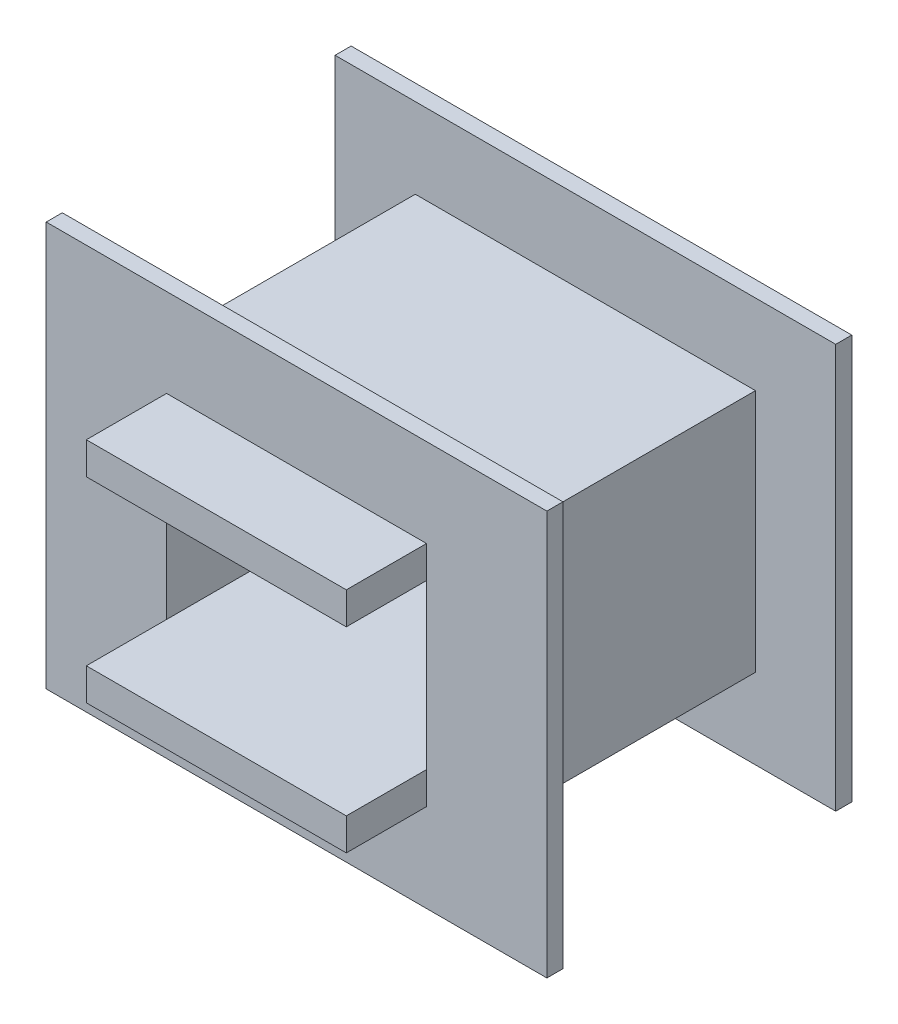
from build123d import *

# Parameters (mm, degrees)
BOSS_EXTRUDE1_DEPTH      = 9.5
BOSS_EXTRUDE1_DEPTH_BACK = 9.5
SKETCH1_W                = 31.2
SKETCH1_H                = 25.2
SKETCH1_W_2              = 16.2
SKETCH1_H_2              = 10.2
SKETCH2_W                = 31.2
SKETCH2_H                = 17
CUT_EXTRUDE1_DEPTH       = 5
SKETCH3_W                = 17
SKETCH3_H                = 15.2
CUT_EXTRUDE2_DEPTH       = 5
SKETCH4_W                = 16.2
SKETCH4_H                = 2
BOSS_EXTRUDE2_DEPTH      = 5
SKETCH6_W                = 16.2
SKETCH6_H                = 5
CUT_EXTRUDE3_DEPTH       = 2


with BuildPart() as part:
    # Sketch1 → Boss-Extrude1 (new, two sides: drawn at the far end of the back side and taken through both)
    with BuildSketch(Plane.XY.offset(-BOSS_EXTRUDE1_DEPTH_BACK)):
        Rectangle(SKETCH1_W, SKETCH1_H)
        Rectangle(SKETCH1_W_2, SKETCH1_H_2, mode=Mode.SUBTRACT)
    extrude(amount=BOSS_EXTRUDE1_DEPTH + BOSS_EXTRUDE1_DEPTH_BACK)

    # Sketch2 → Cut-Extrude1 (cut)
    with BuildSketch(Plane(origin=(0, 12.6, 0), x_dir=(1, 0, 0), z_dir=(0, 1, 0))):
        Rectangle(SKETCH2_W, SKETCH2_H)
    cut_extrude1 = extrude(amount=-CUT_EXTRUDE1_DEPTH, mode=Mode.SUBTRACT)

    # Mirror1: Cut-Extrude1 across plane
    add(cut_extrude1.mirror(Plane.ZX), mode=Mode.SUBTRACT)

    # Sketch3 → Cut-Extrude2 (cut)
    with BuildSketch(Plane(origin=(15.6, 0, 0), x_dir=(0, 0, -1), z_dir=(1, 0, 0))):
        Rectangle(SKETCH3_W, SKETCH3_H)
    cut_extrude2 = extrude(amount=-CUT_EXTRUDE2_DEPTH, mode=Mode.SUBTRACT)

    # Mirror2: Cut-Extrude2 across plane
    add(cut_extrude2.mirror(Plane(origin=(0, 0, 0), x_dir=(0, 0, 1), z_dir=(1, 0, 0))), mode=Mode.SUBTRACT)

    # Sketch4 → Boss-Extrude2 (add)
    with BuildSketch(Plane.XY.offset(9.5)):
        with Locations((0, 6.1)):
            Rectangle(SKETCH4_W, SKETCH4_H)
        with Locations((0, -6.1)):
            Rectangle(SKETCH4_W, SKETCH4_H)
    boss_extrude2 = extrude(amount=BOSS_EXTRUDE2_DEPTH)

    # Mirror3: Boss-Extrude2 across plane
    add(boss_extrude2.mirror(Plane.XY))

    # Sketch6 → Cut-Extrude3 (cut)
    with BuildSketch(Plane(origin=(0, 7.1, 0), x_dir=(1, 0, 0), z_dir=(0, 1, 0))):
        with Locations((0, 12)):
            Rectangle(SKETCH6_W, SKETCH6_H)
    extrude(amount=-CUT_EXTRUDE3_DEPTH, mode=Mode.SUBTRACT)


solid = part.part
